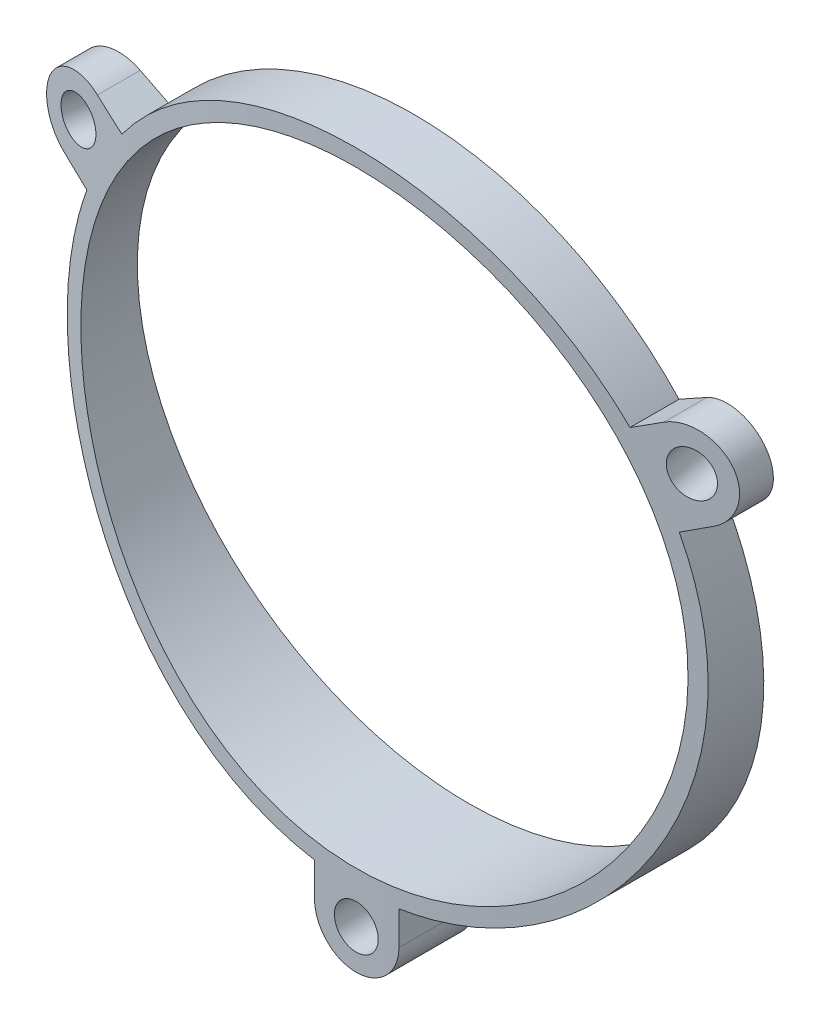
from build123d import *

# Parameters (mm, degrees)
SKETCH_1_R                              = 38
SKETCH_1_R_2                            = 36
EXTRUDE_310_DEPTH                       = 15
EXTRUDE_START                           = -9
EXTRUDE_4_DEPTH                         = 9
FILLET_3_RADIUS                         = 5
FILLET_3_LENGTH                         = 9
PATTERN_CIRCULAR_4_COUNT                = 3
FILLET_3_OF_PATTERN_CIRCULAR_4_2_RADIUS = 5
FILLET_3_OF_PATTERN_CIRCULAR_4_2_LENGTH = 9
FILLET_3_OF_PATTERN_CIRCULAR_4_3_RADIUS = 5
FILLET_3_OF_PATTERN_CIRCULAR_4_3_LENGTH = 9
SKETCH_6_W                              = 176.950469939
SKETCH_6_H                              = 123.439451547
CUT_REVOLVE_861_ANGLE                   = 5
SKETCH_14_W                             = 84.084463922
SKETCH_14_H                             = 246.249240822
MM_7_D                                  = 5.2
MM_7_ON_FACE_2_D                        = 5.2
MM_7_ON_FACE_3_D                        = 5.2


with BuildPart() as part:
    # 草图1 → Extrude 310 (new body)
    with BuildSketch(Plane.XY):
        Circle(SKETCH_1_R)
        Circle(SKETCH_1_R_2, mode=Mode.SUBTRACT)
    extrude(amount=EXTRUDE_310_DEPTH)

    # 草图11 → 凸台-拉伸4 (add)
    with BuildSketch(Plane.XY.offset(15).offset(EXTRUDE_START)):
        with BuildLine():
            Line((-5, -37.669616404), (-5, -46.669616404))
            Line((-5, -46.669616404), (5, -46.669616404))
            Line((5, -46.669616404), (5, -37.669616404))
            ThreePointArc((5, -37.669616404), (0, -38), (-5, -37.669616404))
        make_face()
    extrude_4 = extrude(amount=EXTRUDE_4_DEPTH)

    # 圆角3: full round fillet: the end face becomes a half cylinder, R = half its width
    fillet_3_face = Plane((0, -46.669616404, 10.5), x_dir=(0, 0, 1), z_dir=(0, -1, 0))  # on the end face: x along it, z out of the body
    fillet_3_slab = fillet_3_face.offset(-FILLET_3_RADIUS / 2) * Box(FILLET_3_LENGTH, 2 * FILLET_3_RADIUS, FILLET_3_RADIUS, mode=Mode.PRIVATE)  # the body's end, R deep
    fillet_3_round = Plane((0, -41.669616404, 10.5), x_dir=(0, -1, 0), z_dir=(0, 0, 1)) * Cylinder(FILLET_3_RADIUS, FILLET_3_LENGTH, mode=Mode.PRIVATE)  # its axis R under the face
    add(fillet_3_slab - fillet_3_round, mode=Mode.SUBTRACT)

    # 阵列(圆周)4: 凸台-拉伸4 ×3 about axis
    pattern_circular_4_axis = Axis((0, 0, 0), (0, 0, 1))
    for i in range(1, PATTERN_CIRCULAR_4_COUNT):
        add(extrude_4.rotate(pattern_circular_4_axis, i * 360 / PATTERN_CIRCULAR_4_COUNT))

    # 圆角3 of Pattern Circular 4 2: full round fillet: the end face becomes a half cylinder, R = half its width
    fillet_3_of_pattern_circular_4_2_face = Plane((40.417073391, 23.334808202, 10.5), x_dir=(0, 0, 1), z_dir=(0.866025403784, 0.5, 0))  # on the end face: x along it, z out of the body
    fillet_3_of_pattern_circular_4_2_slab = fillet_3_of_pattern_circular_4_2_face.offset(-FILLET_3_OF_PATTERN_CIRCULAR_4_2_RADIUS / 2) * Box(FILLET_3_OF_PATTERN_CIRCULAR_4_2_LENGTH, 2 * FILLET_3_OF_PATTERN_CIRCULAR_4_2_RADIUS, FILLET_3_OF_PATTERN_CIRCULAR_4_2_RADIUS, mode=Mode.PRIVATE)  # the body's end, R deep
    fillet_3_of_pattern_circular_4_2_round = Plane((36.086946372, 20.834808202, 10.5), x_dir=(0.866025403784, 0.5, 0), z_dir=(0, 0, 1)) * Cylinder(FILLET_3_OF_PATTERN_CIRCULAR_4_2_RADIUS, FILLET_3_OF_PATTERN_CIRCULAR_4_2_LENGTH, mode=Mode.PRIVATE)  # its axis R under the face
    add(fillet_3_of_pattern_circular_4_2_slab - fillet_3_of_pattern_circular_4_2_round, mode=Mode.SUBTRACT)

    # 圆角3 of Pattern Circular 4 3: full round fillet: the end face becomes a half cylinder, R = half its width
    fillet_3_of_pattern_circular_4_3_face = Plane((-40.417073391, 23.334808202, 10.5), x_dir=(0, 0, 1), z_dir=(-0.866025403784, 0.5, 0))  # on the end face: x along it, z out of the body
    fillet_3_of_pattern_circular_4_3_slab = fillet_3_of_pattern_circular_4_3_face.offset(-FILLET_3_OF_PATTERN_CIRCULAR_4_3_RADIUS / 2) * Box(FILLET_3_OF_PATTERN_CIRCULAR_4_3_LENGTH, 2 * FILLET_3_OF_PATTERN_CIRCULAR_4_3_RADIUS, FILLET_3_OF_PATTERN_CIRCULAR_4_3_RADIUS, mode=Mode.PRIVATE)  # the body's end, R deep
    fillet_3_of_pattern_circular_4_3_round = Plane((-36.086946372, 20.834808202, 10.5), x_dir=(-0.866025403784, 0.5, 0), z_dir=(0, 0, 1)) * Cylinder(FILLET_3_OF_PATTERN_CIRCULAR_4_3_RADIUS, FILLET_3_OF_PATTERN_CIRCULAR_4_3_LENGTH, mode=Mode.PRIVATE)  # its axis R under the face
    add(fillet_3_of_pattern_circular_4_3_slab - fillet_3_of_pattern_circular_4_3_round, mode=Mode.SUBTRACT)

    # 草图6 → Cut-Revolve 861 (revolve, cut)
    with BuildSketch(Plane.XY):
        with Locations((-6.549725274, 19.685381772)):
            Rectangle(SKETCH_6_W, SKETCH_6_H)
    revolve(axis=Axis((41.8, -55, 0), (1, 0, 0)), revolution_arc=CUT_REVOLVE_861_ANGLE, mode=Mode.SUBTRACT)

    # 草图14 → Cut-Revolve 1016 (revolve, cut)
    with BuildSketch(Plane(origin=(0, 0, 0), x_dir=(0, 0, -1), z_dir=(1, 0, 0))):
        with Locations((-57.042231961, 14.211955097)):
            Rectangle(SKETCH_14_W, SKETCH_14_H)
    revolve(axis=Axis((0, 42.23348082, -180), (0, -1, 0)), mode=Mode.SUBTRACT)

    # 大小mm 暗销孔7 (through all)
    with Locations(Plane(origin=(-36.373066959, 21, 11.577660493), x_dir=(0.98244954099, 0, 0.186528548507), z_dir=(-0.186528548507, 0, 0.98244954099))):
        with Locations((0, 0)):
            Hole(MM_7_D / 2)

    # 大小mm 暗销孔7 on face 2 (through all)
    with Locations(Plane(origin=(0, -42, 15), x_dir=(1, 0, 0), z_dir=(0, 0, 1))):
        with Locations((0, 0)):
            Hole(MM_7_ON_FACE_2_D / 2)

    # 大小mm 暗销孔7 on face 3 (through all)
    with Locations(Plane(origin=(36.373066959, 21, 11.577660493), x_dir=(0.982449474222, 0, -0.186528900175), z_dir=(0.186528900175, 0, 0.982449474222))):
        with Locations((0, 0)):
            Hole(MM_7_ON_FACE_3_D / 2)


solid = part.part
